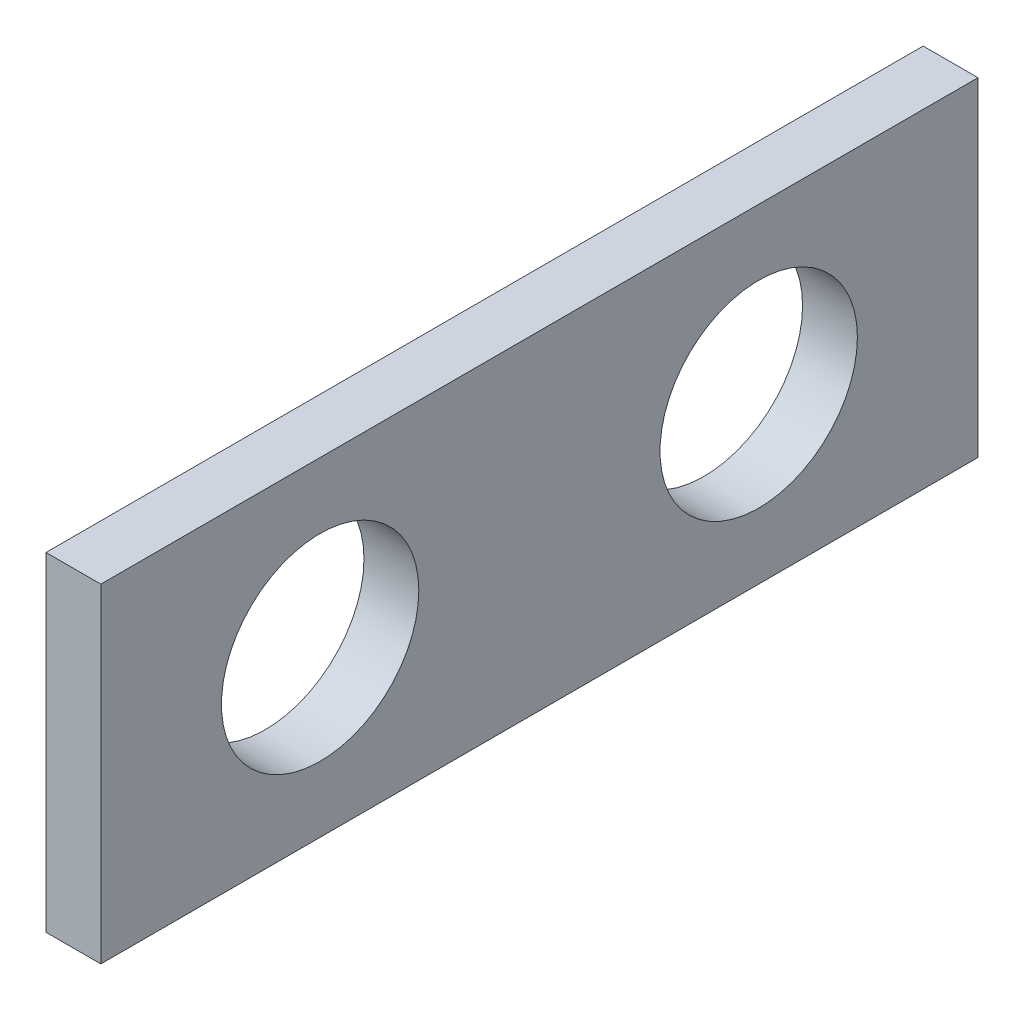
from build123d import *

# Parameters (mm, degrees)
SKETCH1_W           = 80
SKETCH1_H           = 30
BOSS_EXTRUDE1_DEPTH = 5
SKETCH2_R           = 9
CUT_EXTRUDE1_DEPTH  = 5


with BuildPart() as part:
    # Sketch1 → Boss-Extrude1 (new body)
    with BuildSketch(Plane(origin=(0, 0, 0), x_dir=(0, 0, -1), z_dir=(1, 0, 0))):
        Rectangle(SKETCH1_W, SKETCH1_H)
    extrude(amount=BOSS_EXTRUDE1_DEPTH)

    # Sketch2 → Cut-Extrude1 (cut)
    with BuildSketch(Plane(origin=(5, 0, 0), x_dir=(0, 0, -1), z_dir=(1, 0, 0))):
        with Locations((20, 0)):
            Circle(SKETCH2_R)
        with Locations((-20, 0)):
            Circle(SKETCH2_R)
    extrude(amount=-CUT_EXTRUDE1_DEPTH, mode=Mode.SUBTRACT)


solid = part.part
